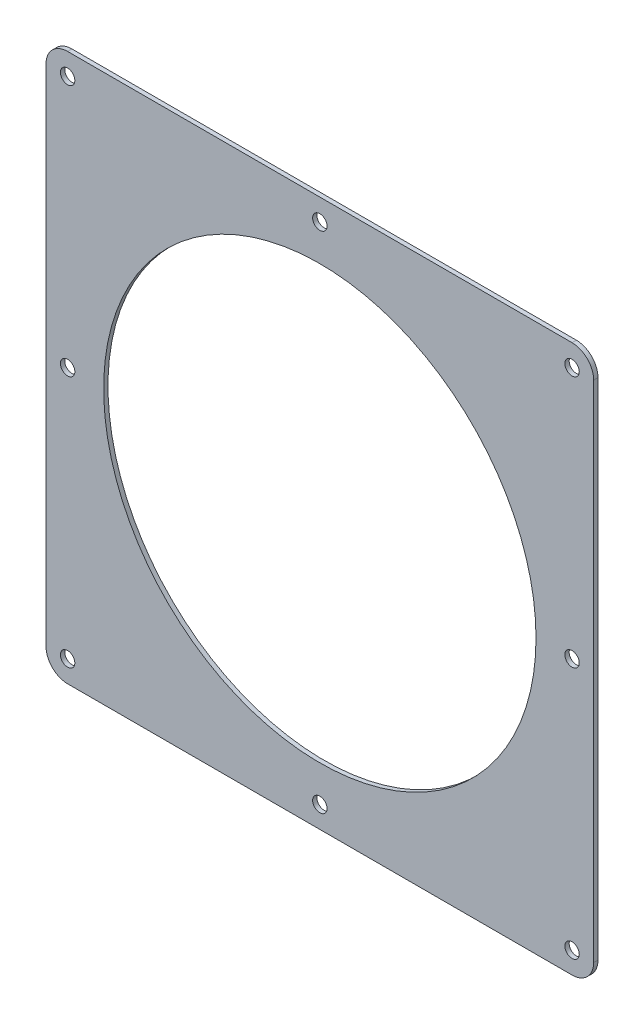
from build123d import *

# Parameters (mm, degrees)
SKETCH2_R           = 5
SKETCH2_R_2         = 150
BOSS_EXTRUDE1_DEPTH = 3


with BuildPart() as part:
    # Sketch2 → Boss-Extrude1 (new body)
    with BuildSketch(Plane.XY):
        with BuildLine():
            Line((-175, 190), (175, 190))
            ThreePointArc((175, 190), (185.606601718, 185.606601718), (190, 175))
            Line((190, 175), (190, -175))
            ThreePointArc((190, -175), (185.606601718, -185.606601718), (175, -190))
            Line((175, -190), (-175, -190))
            ThreePointArc((-175, -190), (-185.606601718, -185.606601718), (-190, -175))
            Line((-190, -175), (-190, 175))
            ThreePointArc((-190, 175), (-185.606601718, 185.606601718), (-175, 190))
        make_face()
        with Locations((-175, 175)):
            Circle(SKETCH2_R, mode=Mode.SUBTRACT)
        with Locations((0, 175)):
            Circle(SKETCH2_R, mode=Mode.SUBTRACT)
        with Locations((175, 175)):
            Circle(SKETCH2_R, mode=Mode.SUBTRACT)
        with Locations((175, 0)):
            Circle(SKETCH2_R, mode=Mode.SUBTRACT)
        with Locations((-175, 0)):
            Circle(SKETCH2_R, mode=Mode.SUBTRACT)
        with Locations((-175, -175)):
            Circle(SKETCH2_R, mode=Mode.SUBTRACT)
        with Locations((0, -175)):
            Circle(SKETCH2_R, mode=Mode.SUBTRACT)
        with Locations((175, -175)):
            Circle(SKETCH2_R, mode=Mode.SUBTRACT)
        Circle(SKETCH2_R_2, mode=Mode.SUBTRACT)
    extrude(amount=BOSS_EXTRUDE1_DEPTH)


solid = part.part
